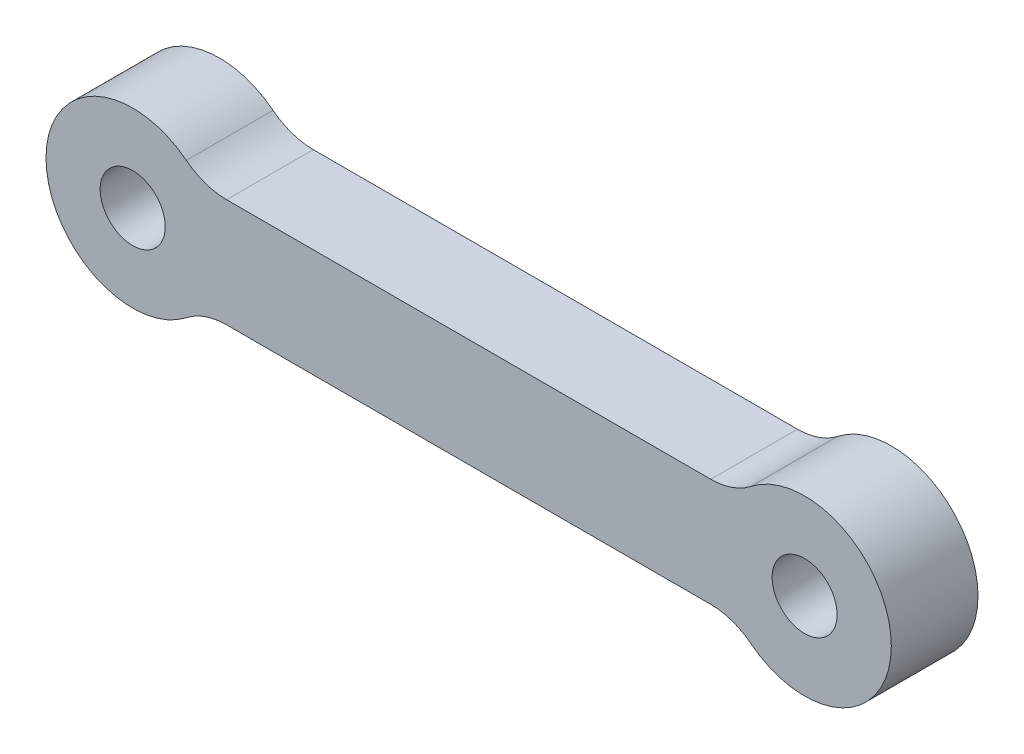
from build123d import *

# Parameters (mm, degrees)
SKETCH1_R           = 1.5
BOSS_EXTRUDE1_DEPTH = 4


with BuildPart() as part:
    # Sketch1 → Boss-Extrude1 (new body)
    with BuildSketch(Plane.XY):
        with BuildLine():
            Line((-11.169872981, 2.5), (11.169872981, 2.5))
            ThreePointArc((11.169872981, 2.5), (12.151853487, 2.665266452), (13.025641703, 3.142857143))
            ThreePointArc((13.025641703, 3.142857143), (19.5, 0), (13.025641703, -3.142857143))
            ThreePointArc((13.025641703, -3.142857143), (12.151853487, -2.665266452), (11.169872981, -2.5))
            Line((11.169872981, -2.5), (-11.169872981, -2.5))
            ThreePointArc((-11.169872981, -2.5), (-12.151853487, -2.665266452), (-13.025641703, -3.142857143))
            ThreePointArc((-13.025641703, -3.142857143), (-19.5, 0), (-13.025641703, 3.142857143))
            ThreePointArc((-13.025641703, 3.142857143), (-12.151853487, 2.665266452), (-11.169872981, 2.5))
        make_face()
        with Locations((-15.5, 0)):
            Circle(SKETCH1_R, mode=Mode.SUBTRACT)
        with Locations(Location((15.5, 0, 0), (0, 0, 180))):
            Circle(SKETCH1_R, mode=Mode.SUBTRACT)
    extrude(amount=BOSS_EXTRUDE1_DEPTH)


solid = part.part
